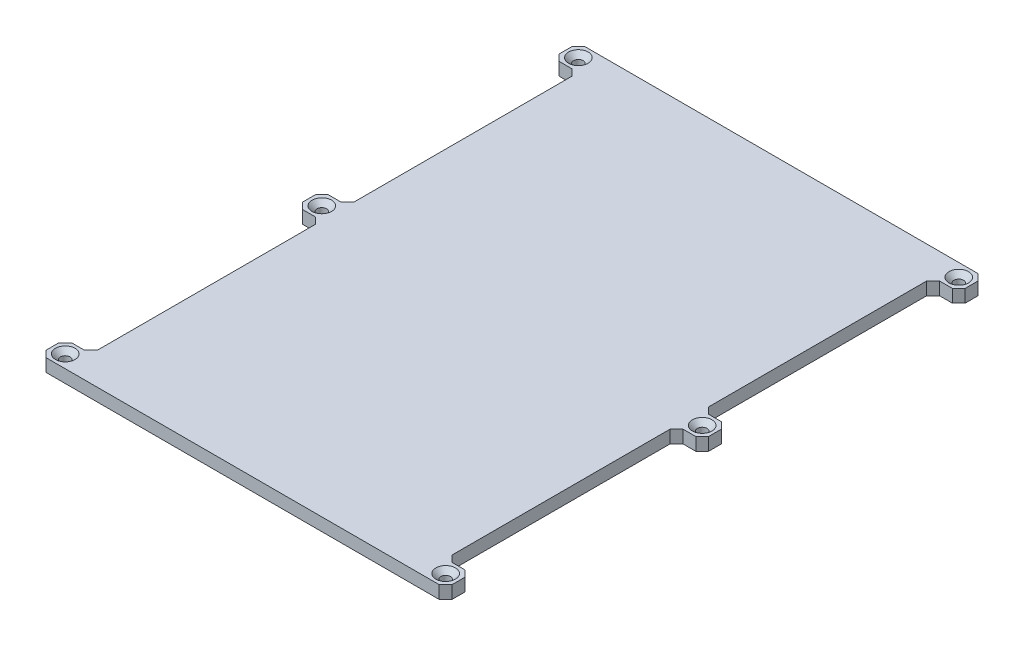
from build123d import *

# Parameters (mm, degrees)
SKETCH1_R           = 1.5
BOSS_EXTRUDE1_DEPTH = 4
CHAMFER1_SIZE       = 2
CHAMFER2_SIZE       = 1.55


with BuildPart() as part:
    # Sketch1 → Boss-Extrude1 (new body)
    with BuildSketch(Plane(origin=(0, 0, 0), x_dir=(1, 0, 0), z_dir=(0, 1, 0))):
        Polygon((0, 0), (110.6, 0), (118.6, 0), (118.6, 8), (110.6, 8), (110.6, 80), (118.6, 80), (118.6, 88), (110.6, 88), (110.6, 160), (118.6, 160), (118.6, 168), (110.6, 168), (0, 168), (-8, 168), (-8, 160), (0, 160), (0, 88), (-8, 88), (-8, 80), (0, 80), (0, 8), (-8, 8), (-8, 0), align=None)
        with Locations(Location((114.6, 164, 0), (0, 0, 270))):
            Circle(SKETCH1_R, mode=Mode.SUBTRACT)
        with Locations(Location((114.6, 84, 0), (0, 0, 90))):
            Circle(SKETCH1_R, mode=Mode.SUBTRACT)
        with Locations(Location((114.6, 4, 0), (0, 0, 270))):
            Circle(SKETCH1_R, mode=Mode.SUBTRACT)
        with Locations(Location((-4, 4, 0), (0, 0, 90))):
            Circle(SKETCH1_R, mode=Mode.SUBTRACT)
        with Locations(Location((-4, 84, 0), (0, 0, 270))):
            Circle(SKETCH1_R, mode=Mode.SUBTRACT)
        with Locations(Location((-4, 164, 0), (0, 0, 90))):
            Circle(SKETCH1_R, mode=Mode.SUBTRACT)
    extrude(amount=BOSS_EXTRUDE1_DEPTH)

    # Chamfer1
    chamfer1_edges = [part.edges().sort_by_distance(p)[0] for p in [
        (-8, 2, 0),
        (-8, 2, -8),
        (0, 2, -8),
        (0, 2, -80),
        (-8, 2, -80),
        (-8, 2, -88),
        (0, 2, -88),
        (0, 2, -160),
        (-8, 2, -160),
        (-8, 2, -168),
        (118.6, 2, -168),
        (118.6, 2, -160),
        (110.6, 2, -160),
        (110.6, 2, -88),
        (118.6, 2, -88),
        (118.6, 2, -80),
        (110.6, 2, -80),
        (110.6, 2, -8),
        (118.6, 2, -8),
        (118.6, 2, 0),
    ]]
    chamfer(chamfer1_edges, length=CHAMFER1_SIZE)

    # Chamfer2
    chamfer2_edges = [part.edges().sort_by_distance(p)[0] for p in [
        (114.6, 4, -165.5),
        (114.6, 4, -82.5),
        (114.6, 4, -5.5),
        (-4, 4, -2.5),
        (-4, 4, -85.5),
        (-4, 4, -162.5),
    ]]
    chamfer(chamfer2_edges, length=CHAMFER2_SIZE)


solid = part.part
